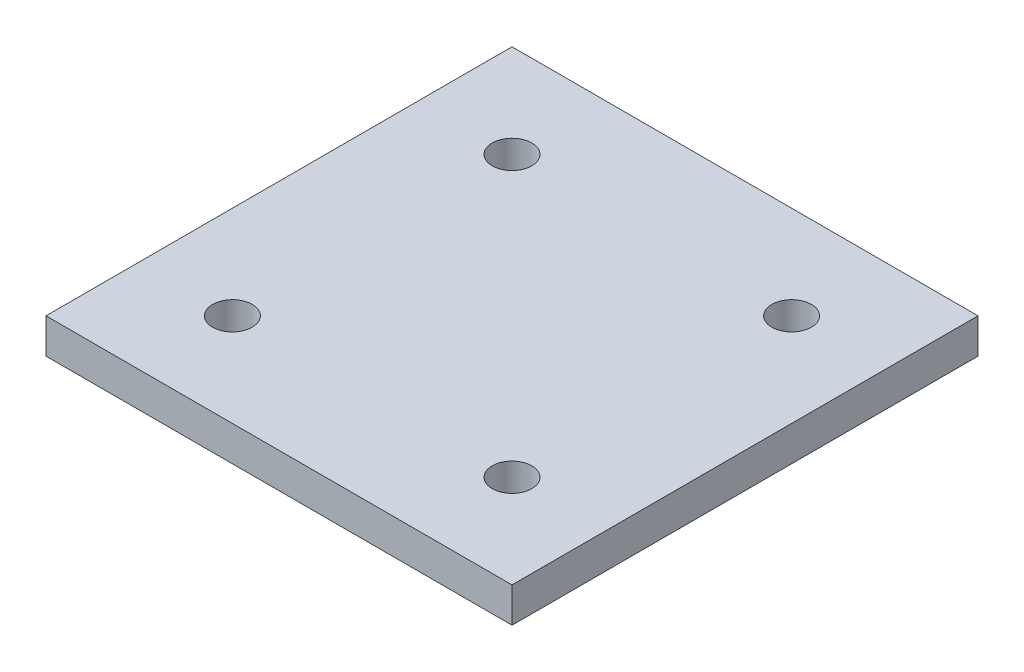
from build123d import *

# Parameters (mm, degrees)
SKETCH1_W             = 40
SKETCH1_H             = 40
CROSS_JOINER_DEPTH    = 3
BOLT_HOLES_DEPTH      = 29.442925307
BOLT_HOLES_DEPTH_BACK = 29.442925307
SKETCH2_R             = 1.7


with BuildPart() as part:
    # Sketch1 → Cross Joiner (new body)
    with BuildSketch(Plane(origin=(0, 0, 0), x_dir=(1, 0, 0), z_dir=(0, 1, 0))):
        Rectangle(SKETCH1_W, SKETCH1_H)
    extrude(amount=CROSS_JOINER_DEPTH)

    # Sketch2 → Bolt Holes (cut, two sides: drawn at the far end of the back side and taken through both)
    with BuildSketch(Plane(origin=(0, 0, 0), x_dir=(1, 0, 0), z_dir=(0, 1, 0)).offset(-BOLT_HOLES_DEPTH_BACK)):
        with Locations(Location((-12, -12, 0), (0, 0, 270))):
            Circle(SKETCH2_R)
        with Locations(Location((-12, 12, 0), (0, 0, 270))):
            Circle(SKETCH2_R)
        with Locations(Location((12, -12, 0), (0, 0, 270))):
            Circle(SKETCH2_R)
        with Locations(Location((12, 12, 0), (0, 0, 270))):
            Circle(SKETCH2_R)
    extrude(amount=BOLT_HOLES_DEPTH + BOLT_HOLES_DEPTH_BACK, mode=Mode.SUBTRACT)


solid = part.part
